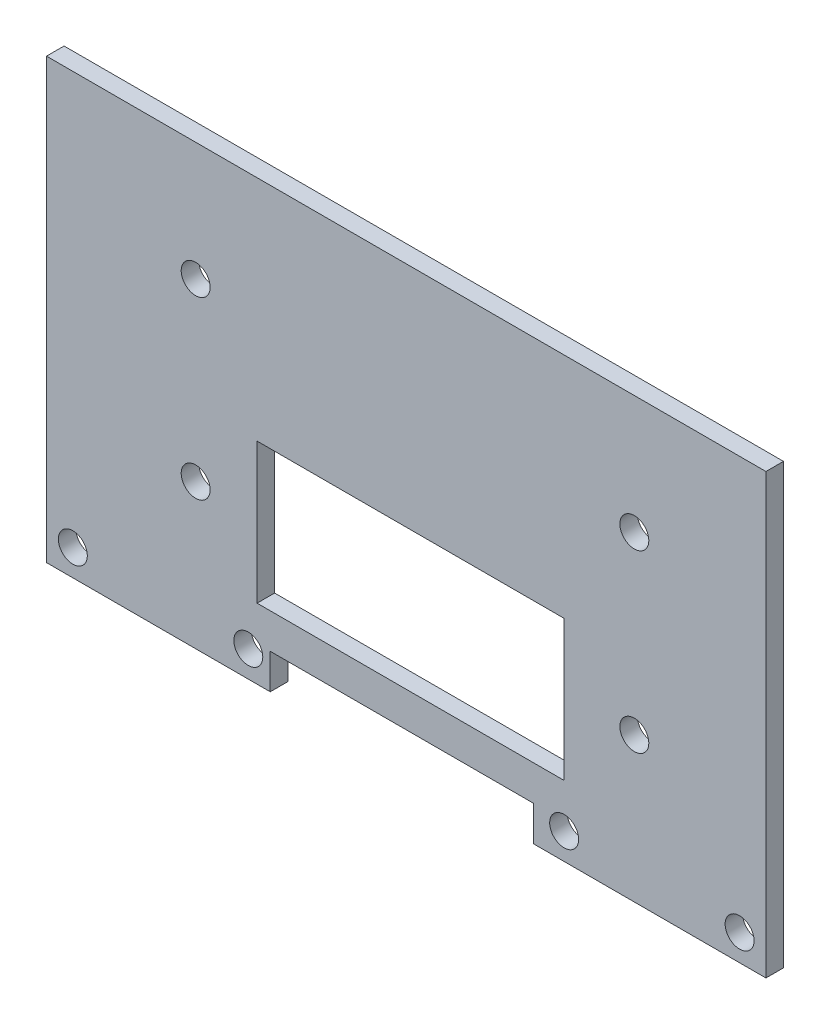
from build123d import *

# Parameters (mm, degrees)
SKETCH_1_W          = 80
SKETCH_1_H          = 50
EXTRUDE_1_DEPTH     = 2
SKETCH_5_W          = 2
SKETCH_5_H          = 50
EXTRUDE_2_DEPTH     = 2
SKETCH_2_W          = 30
SKETCH_2_H          = 4
SKETCH_2_W_2        = 35
SKETCH_2_H_2        = 16
CUT_EXTRUDE_1_DEPTH = 49.918299235
SKETCH_3_R          = 1.65
CUT_EXTRUDE_2_DEPTH = 49.918299235
SKETCH_6_W          = 1.5
SKETCH_6_H          = 4
CUT_EXTRUDE_4_DEPTH = 49.918299235
SKETCH_7_W          = 1.5
SKETCH_7_H          = 4
EXTRUDE_3_DEPTH     = 2
SKETCH_8_R          = 1.65
CUT_EXTRUDE_5_DEPTH = 49.918299235


with BuildPart() as part:
    # 草图1 → 凸台-拉伸1 (new body)
    with BuildSketch(Plane.XY):
        Rectangle(SKETCH_1_W, SKETCH_1_H)
    extrude(amount=EXTRUDE_1_DEPTH)

    # 草图5 → 凸台-拉伸2 (add)
    with BuildSketch(Plane.XY.offset(2)):
        with Locations((-41, 0)):
            Rectangle(SKETCH_5_W, SKETCH_5_H)
    extrude(amount=-EXTRUDE_2_DEPTH)

    # 草图2 → 切除-拉伸1 (cut, through all)
    with BuildSketch(Plane.XY.offset(2)):
        with Locations((0, -23)):
            Rectangle(SKETCH_2_W, SKETCH_2_H)
        with Locations((-0.5, -9)):
            Rectangle(SKETCH_2_W_2, SKETCH_2_H_2)
    extrude(amount=-CUT_EXTRUDE_1_DEPTH, mode=Mode.SUBTRACT)

    # 草图3 → 切除-拉伸2 (cut, through all)
    with BuildSketch(Plane.XY.offset(2)):
        with Locations((-39, -22)):
            Circle(SKETCH_3_R)
        with Locations((-19, -22)):
            Circle(SKETCH_3_R)
        with Locations(Location((17, -22, 0), (0, 0, 180))):
            Circle(SKETCH_3_R)
        with Locations(Location((37, -22, 0), (0, 0, 180))):
            Circle(SKETCH_3_R)
    extrude(amount=-CUT_EXTRUDE_2_DEPTH, mode=Mode.SUBTRACT)

    # 草图6 → 切除-拉伸4 (cut, through all)
    with BuildSketch(Plane.XY.offset(2)):
        with Locations((-15.75, -23)):
            Rectangle(SKETCH_6_W, SKETCH_6_H)
    extrude(amount=-CUT_EXTRUDE_4_DEPTH, mode=Mode.SUBTRACT)

    # 草图7 → 凸台-拉伸3 (add)
    with BuildSketch(Plane.XY.offset(2)):
        with Locations((14.25, -23)):
            Rectangle(SKETCH_7_W, SKETCH_7_H)
    extrude(amount=-EXTRUDE_3_DEPTH)

    # 草图8 → 切除-拉伸5 (cut, through all)
    with BuildSketch(Plane.XY.offset(2)):
        with Locations((-25, 11.5)):
            Circle(SKETCH_8_R)
        with Locations((-25, -8.5)):
            Circle(SKETCH_8_R)
        with Locations((25, -8.5)):
            Circle(SKETCH_8_R)
        with Locations((25, 11.5)):
            Circle(SKETCH_8_R)
    extrude(amount=-CUT_EXTRUDE_5_DEPTH, mode=Mode.SUBTRACT)


solid = part.part
